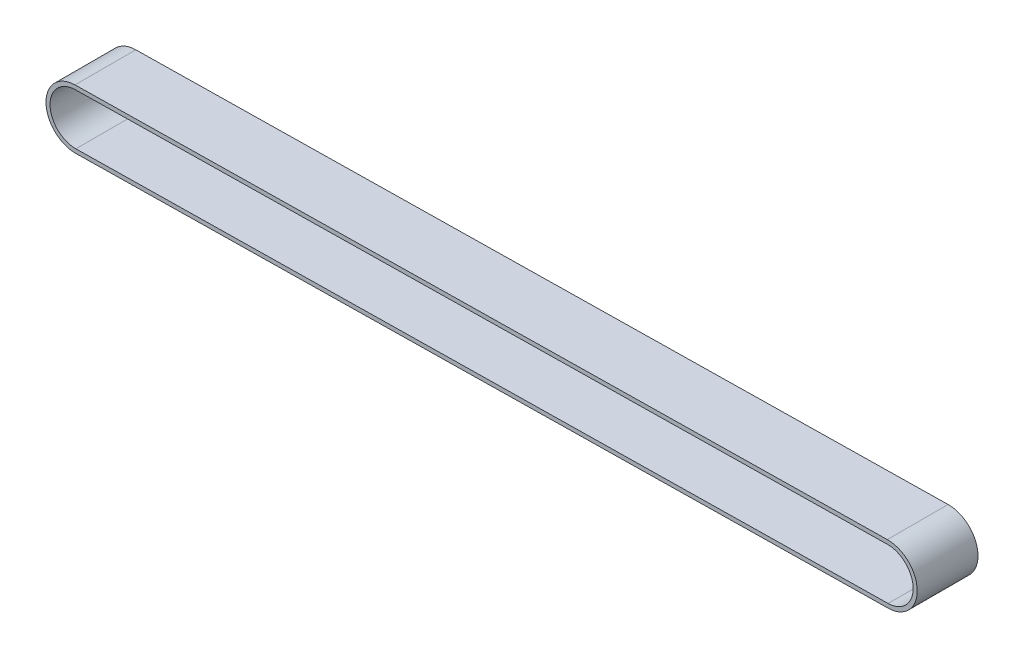
from build123d import *

# Parameters (mm, degrees)
EXTRUDE_THIN1_DEPTH = 7.5


with BuildPart() as part:
    # Sketch2 → Extrude-Thin1 (new, symmetric)
    with BuildSketch(Plane.XY):
        with BuildLine():
            Line((200.572178166, -4.229157512), (0.110751633, -7.279157511))
            ThreePointArc((0.110751633, -7.279157511), (-7.279157511, -0.110751633), (-0.110751633, 7.279157511))
            Line((-0.110751633, 7.279157511), (200.350674899, 10.329157511))
            ThreePointArc((200.350674899, 10.329157511), (207.740584044, 3.160751633), (200.572178166, -4.229157512))
        make_face()
        with BuildLine():
            Line((200.556965029, -3.229273238), (0.095538497, -6.279273238))
            ThreePointArc((0.095538497, -6.279273238), (-6.279273238, -0.095538497), (-0.095538497, 6.279273238))
            Line((-0.095538497, 6.279273238), (200.365888036, 9.329273238))
            ThreePointArc((200.365888036, 9.329273238), (206.74069977, 3.145538497), (200.556965029, -3.229273238))
        make_face(mode=Mode.SUBTRACT)
    extrude(amount=EXTRUDE_THIN1_DEPTH, both=True)


solid = part.part
